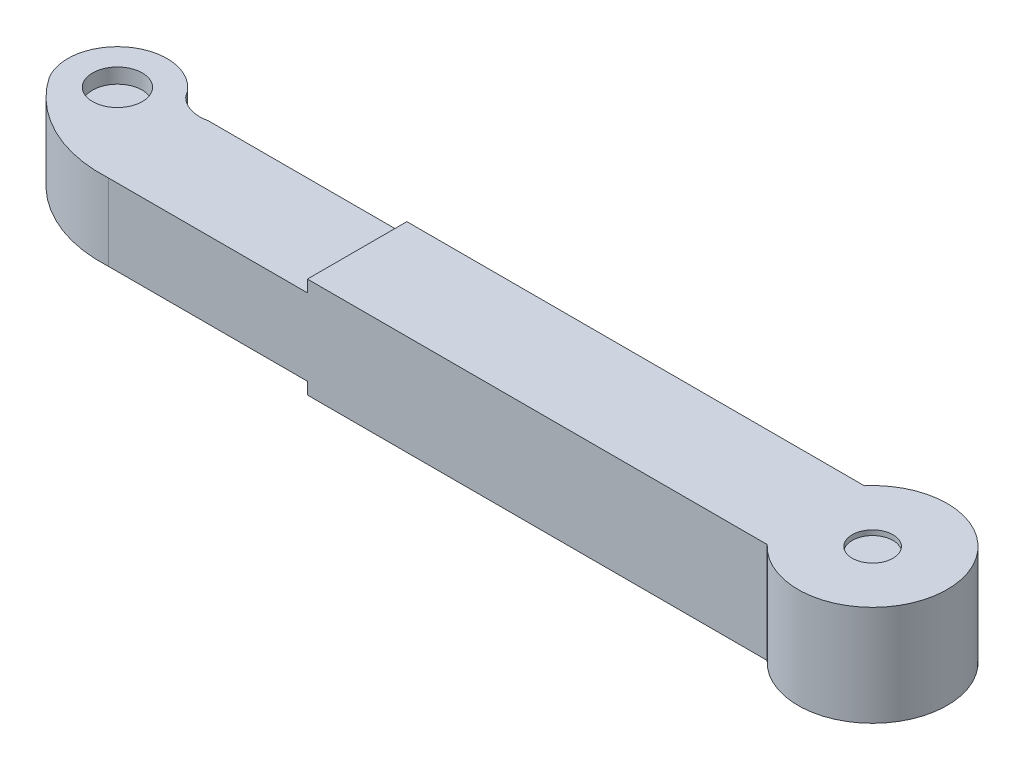
from build123d import *

# Parameters (mm, degrees)
SALIENTE_EXTRUIR1_DEPTH = 10.1
CROQUIS4_W              = 20
CROQUIS4_H              = 1.2
CORTAR_EXTRUIR1_DEPTH   = 10
SALIENTE_EXTRUIR2_START = -7.7
SALIENTE_EXTRUIR2_DEPTH = 7.7
CROQUIS6_R              = 2.5
CORTAR_EXTRUIR2_DEPTH   = 1.5
CROQUIS7_R              = 2.05
CORTAR_EXTRUIR3_DEPTH   = 0.5


with BuildPart() as part:
    # Croquis3 → Saliente-Extruir1 (new body)
    with BuildSketch(Plane(origin=(0, 0, 0), x_dir=(1, 0, 0), z_dir=(0, 1, 0))):
        with BuildLine():
            Line((33.362812396, -5.019964628), (-32.868233457, -5.019964628))
            Line((-32.868233457, -5.019964628), (-32.868233457, 4.980035372))
            Line((-32.868233457, 4.980035372), (33.131766543, 4.980035372))
            ThreePointArc((33.131766543, 4.980035372), (46.332773431, 0.282370053), (33.362812396, -5.019964628))
        make_face()
    extrude(amount=SALIENTE_EXTRUIR1_DEPTH)

    # Croquis4 → Cortar-Extruir1 (cut)
    with BuildSketch(Plane.XY.offset(5.019964628)):
        with Locations((-22.868233457, 9.5)):
            Rectangle(CROQUIS4_W, CROQUIS4_H)
    cortar_extruir1 = extrude(amount=-CORTAR_EXTRUIR1_DEPTH, mode=Mode.SUBTRACT)

    # Simetría1: Cortar-Extruir1 across plane
    add(cortar_extruir1.mirror(Plane.ZX.offset(5.05)), mode=Mode.SUBTRACT)

    # Croquis5 → Saliente-Extruir2 (add)
    with BuildSketch(Plane(origin=(0, 8.9, 0), x_dir=(1, 0, 0), z_dir=(0, 1, 0)).offset(SALIENTE_EXTRUIR2_START)):
        with BuildLine():
            Line((-32.868233457, 4.980035372), (-32.868233457, -5.019964628))
            ThreePointArc((-32.868233457, -5.019964628), (-39.493870843, -3.678231071), (-44.60405989, 0.747295745))
            ThreePointArc((-44.60405989, 0.747295745), (-42.906522418, 7.611577683), (-36.04224048, 5.914040211))
            ThreePointArc((-36.04224048, 5.914040211), (-34.577950006, 5.030024916), (-32.868233457, 4.980035372))
        make_face()
    extrude(amount=SALIENTE_EXTRUIR2_DEPTH)

    # Croquis6 → Cortar-Extruir2 (cut)
    with BuildSketch(Plane(origin=(0, 8.9, 0), x_dir=(1, 0, 0), z_dir=(0, 1, 0))):
        with Locations(Location((-40.323150185, 3.330667978, 0), (0, 0, 270))):
            Circle(CROQUIS6_R)
    cortar_extruir2 = extrude(amount=-CORTAR_EXTRUIR2_DEPTH, mode=Mode.SUBTRACT)

    # Simetría2: Cortar-Extruir2 across plane
    add(cortar_extruir2.mirror(Plane.ZX.offset(5.05)), mode=Mode.SUBTRACT)

    # Croquis7 → Cortar-Extruir3 (cut)
    with BuildSketch(Plane(origin=(0, 10.1, 0), x_dir=(1, 0, 0), z_dir=(0, 1, 0))):
        with Locations(Location((38.834774462, 0.109131896, 0), (0, 0, 270))):
            Circle(CROQUIS7_R)
    extrude(amount=-CORTAR_EXTRUIR3_DEPTH, mode=Mode.SUBTRACT)


solid = part.part
